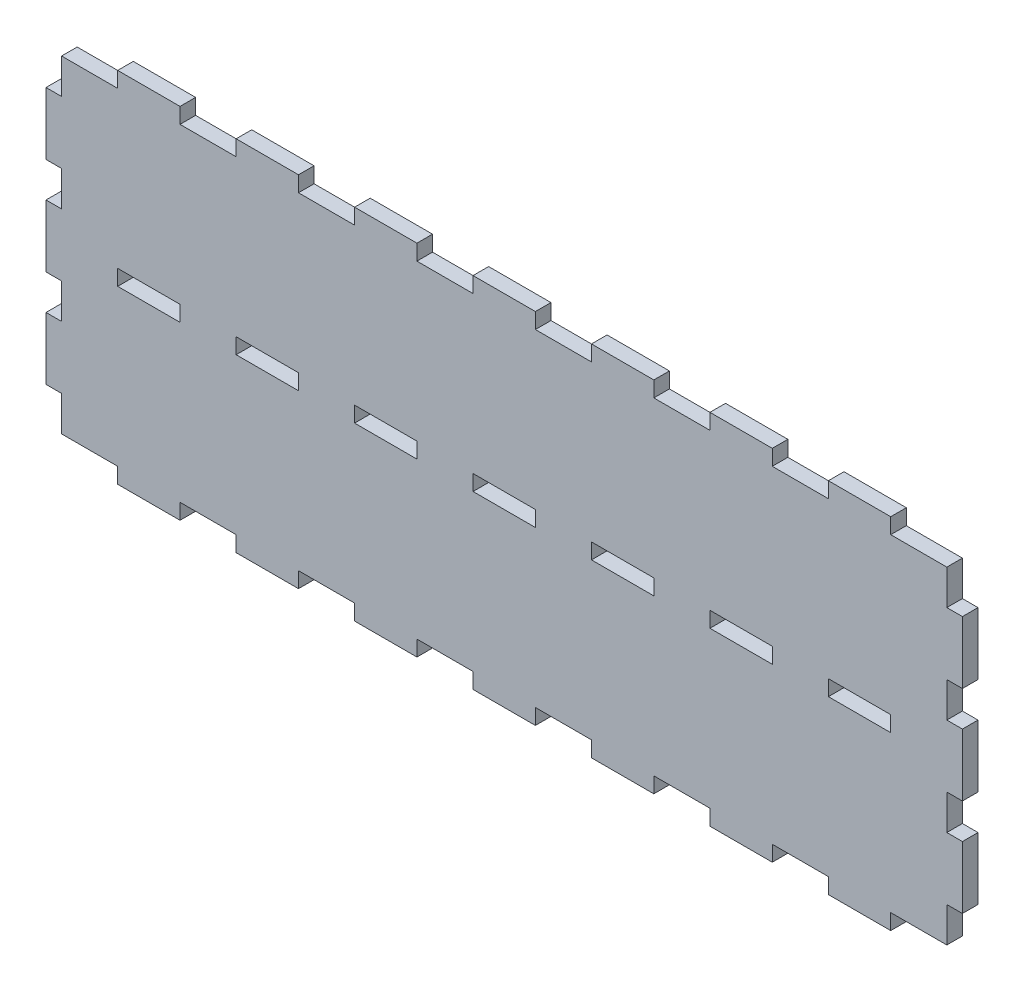
from build123d import *

# Parameters (mm, degrees)
SKETCH1_W           = 10
SKETCH1_H           = 2.5
BOSS_EXTRUDE1_DEPTH = 2.5


with BuildPart() as part:
    # Sketch1 → Boss-Extrude1 (new body)
    with BuildSketch(Plane.XY):
        Polygon((-62, 26.25), (-62, 28.75), (-52, 28.75), (-52, 26.25), (-43, 26.25), (-43, 28.75), (-33, 28.75), (-33, 26.25), (-24, 26.25), (-24, 28.75), (-14, 28.75), (-14, 26.25), (-5, 26.25), (-5, 28.75), (5, 28.75), (5, 26.25), (14, 26.25), (14, 28.75), (24, 28.75), (24, 26.25), (33, 26.25), (33, 28.75), (43, 28.75), (43, 26.25), (52, 26.25), (52, 28.75), (62, 28.75), (62, 26.25), (71, 26.25), (71, 20.625), (73.5, 20.625), (73.5, 10.625), (71, 10.625), (71, 5), (73.5, 5), (73.5, -5), (71, -5), (71, -10.625), (73.5, -10.625), (73.5, -20.625), (71, -20.625), (71, -26.25), (62, -26.25), (62, -28.75), (52, -28.75), (52, -26.25), (43, -26.25), (43, -28.75), (33, -28.75), (33, -26.25), (24, -26.25), (24, -28.75), (14, -28.75), (14, -26.25), (5, -26.25), (5, -28.75), (-5, -28.75), (-5, -26.25), (-14, -26.25), (-14, -28.75), (-24, -28.75), (-24, -26.25), (-33, -26.25), (-33, -28.75), (-43, -28.75), (-43, -26.25), (-52, -26.25), (-52, -28.75), (-62, -28.75), (-62, -26.25), (-71, -26.25), (-71, -20.625), (-73.5, -20.625), (-73.5, -10.625), (-71, -10.625), (-71, -5), (-73.5, -5), (-73.5, 5), (-71, 5), (-71, 10.625), (-73.5, 10.625), (-73.5, 20.625), (-71, 20.625), (-71, 26.25), align=None)
        with Locations((-38, 0)):
            Rectangle(SKETCH1_W, SKETCH1_H, mode=Mode.SUBTRACT)
        with Locations((-57, 0)):
            Rectangle(SKETCH1_W, SKETCH1_H, mode=Mode.SUBTRACT)
        with Locations((-19, 0)):
            Rectangle(SKETCH1_W, SKETCH1_H, mode=Mode.SUBTRACT)
        Rectangle(SKETCH1_W, SKETCH1_H, mode=Mode.SUBTRACT)
        with Locations((19, 0)):
            Rectangle(SKETCH1_W, SKETCH1_H, mode=Mode.SUBTRACT)
        with Locations((38, 0)):
            Rectangle(SKETCH1_W, SKETCH1_H, mode=Mode.SUBTRACT)
        with Locations((57, 0)):
            Rectangle(SKETCH1_W, SKETCH1_H, mode=Mode.SUBTRACT)
    extrude(amount=BOSS_EXTRUDE1_DEPTH)


solid = part.part
